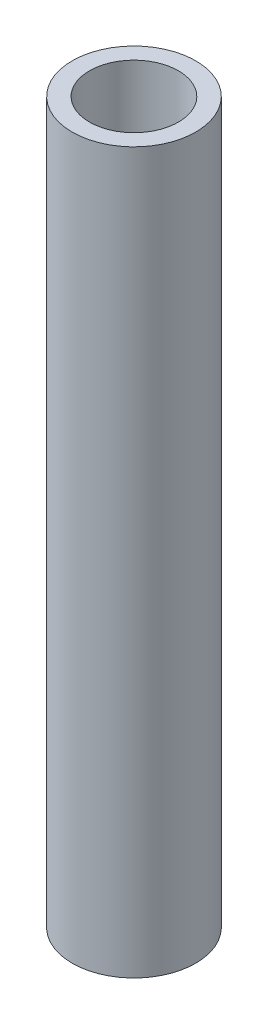
from build123d import *

# Parameters (mm, degrees)
SKETCH1_R           = 3.175
SKETCH1_R_2         = 2.286
BOSS_EXTRUDE1_DEPTH = 37


with BuildPart() as part:
    # Sketch1 → Boss-Extrude1 (new body)
    with BuildSketch(Plane(origin=(0, 0, 0), x_dir=(1, 0, 0), z_dir=(0, 1, 0))):
        with Locations(Location((0, 0, 0), (0, 0, 270))):
            Circle(SKETCH1_R)
        with Locations(Location((0, 0, 0), (0, 0, 270))):
            Circle(SKETCH1_R_2, mode=Mode.SUBTRACT)
    extrude(amount=BOSS_EXTRUDE1_DEPTH)


solid = part.part
